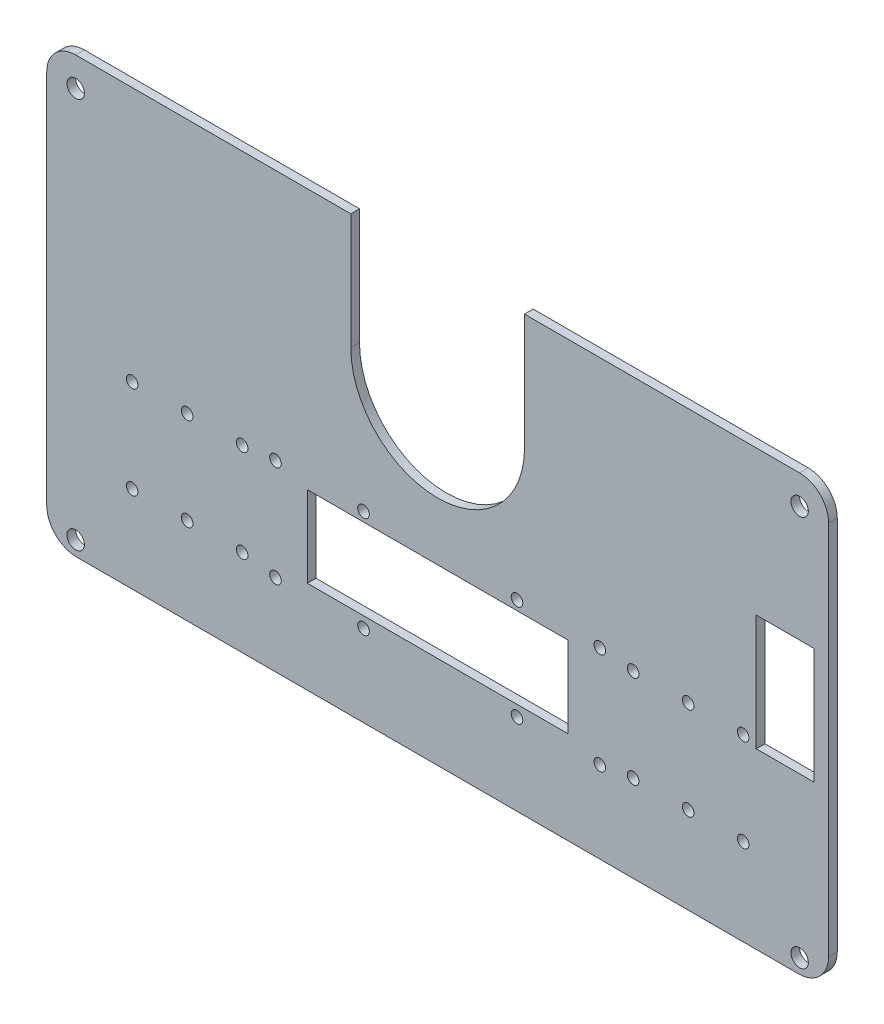
from build123d import *

# Parameters (mm, degrees)
ESQUISSE1_R             = 2
BOSS_EXTRU_1_DEPTH      = 3
ESQUISSE2_R             = 3
ESQUISSE2_W             = 90
ESQUISSE2_H             = 28
ENL_V_MAT_EXTRU_1_DEPTH = 3
ESQUISSE3_W             = 20
ESQUISSE3_H             = 40
ENL_V_MAT_EXTRU_2_DEPTH = 10


with BuildPart() as part:
    # Esquisse1 → Boss.-Extru.1 (new body)
    with BuildSketch(Plane.XY):
        with BuildLine():
            Line((10, 0), (105, 0))
            Line((105, 0), (105, -40))
            ThreePointArc((105, -40), (135, -70), (165, -40))
            Line((165, -40), (165, 0))
            Line((165, 0), (260, 0))
            ThreePointArc((260, 0), (267.071067812, -2.928932188), (270, -10))
            Line((270, -10), (270, -139.676541182))
            ThreePointArc((270, -139.676541182), (266.976328917, -146.976328917), (259.676541182, -150))
            Line((259.676541182, -150), (10.323458818, -150))
            ThreePointArc((10.323458818, -150), (3.023671083, -146.976328917), (0, -139.676541182))
            Line((0, -139.676541182), (0, -10))
            ThreePointArc((0, -10), (2.928932188, -2.928932188), (10, 0))
        make_face()
        with Locations((221.512678431, -88)):
            Circle(ESQUISSE1_R, mode=Mode.SUBTRACT)
        with Locations((202.512678431, -88)):
            Circle(ESQUISSE1_R, mode=Mode.SUBTRACT)
        with Locations((240.512678431, -88)):
            Circle(ESQUISSE1_R, mode=Mode.SUBTRACT)
        with Locations((221.512678431, -120)):
            Circle(ESQUISSE1_R, mode=Mode.SUBTRACT)
        with Locations((240.512678431, -120)):
            Circle(ESQUISSE1_R, mode=Mode.SUBTRACT)
        with Locations((202.512678431, -120)):
            Circle(ESQUISSE1_R, mode=Mode.SUBTRACT)
        with Locations((67.487321569, -88)):
            Circle(ESQUISSE1_R, mode=Mode.SUBTRACT)
        with Locations((48.487321569, -88)):
            Circle(ESQUISSE1_R, mode=Mode.SUBTRACT)
        with Locations((29.487321569, -88)):
            Circle(ESQUISSE1_R, mode=Mode.SUBTRACT)
        with Locations((29.487321569, -120)):
            Circle(ESQUISSE1_R, mode=Mode.SUBTRACT)
        with Locations((48.487321569, -120)):
            Circle(ESQUISSE1_R, mode=Mode.SUBTRACT)
        with Locations((67.487321569, -120)):
            Circle(ESQUISSE1_R, mode=Mode.SUBTRACT)
        with Locations((191, -121.789429788)):
            Circle(ESQUISSE1_R, mode=Mode.SUBTRACT)
        with Locations((191, -86.789429788)):
            Circle(ESQUISSE1_R, mode=Mode.SUBTRACT)
        with Locations((162.4, -86.789429788)):
            Circle(ESQUISSE1_R, mode=Mode.SUBTRACT)
        with Locations((162.4, -121.789429788)):
            Circle(ESQUISSE1_R, mode=Mode.SUBTRACT)
        with Locations((109.4, -86.789429788)):
            Circle(ESQUISSE1_R, mode=Mode.SUBTRACT)
        with Locations((109.4, -121.789429788)):
            Circle(ESQUISSE1_R, mode=Mode.SUBTRACT)
        with Locations((79, -86.789429788)):
            Circle(ESQUISSE1_R, mode=Mode.SUBTRACT)
        with Locations((79, -121.789429788)):
            Circle(ESQUISSE1_R, mode=Mode.SUBTRACT)
    extrude(amount=BOSS_EXTRU_1_DEPTH)

    # Esquisse2 → Enlèv. mat.-Extru.1 (cut)
    with BuildSketch(Plane.XY.offset(3)):
        with Locations((10, -10)):
            Circle(ESQUISSE2_R)
        with Locations((260, -10)):
            Circle(ESQUISSE2_R)
        with Locations((260, -145)):
            Circle(ESQUISSE2_R)
        with Locations((10, -145)):
            Circle(ESQUISSE2_R)
        with Locations((135, -104)):
            Rectangle(ESQUISSE2_W, ESQUISSE2_H)
    extrude(amount=-ENL_V_MAT_EXTRU_1_DEPTH, mode=Mode.SUBTRACT)

    # Esquisse3 → Enlèv. mat.-Extru.2 (cut)
    with BuildSketch(Plane.XY.offset(3)):
        with Locations((255, -70)):
            Rectangle(ESQUISSE3_W, ESQUISSE3_H)
    extrude(amount=-ENL_V_MAT_EXTRU_2_DEPTH, mode=Mode.SUBTRACT)


solid = part.part
